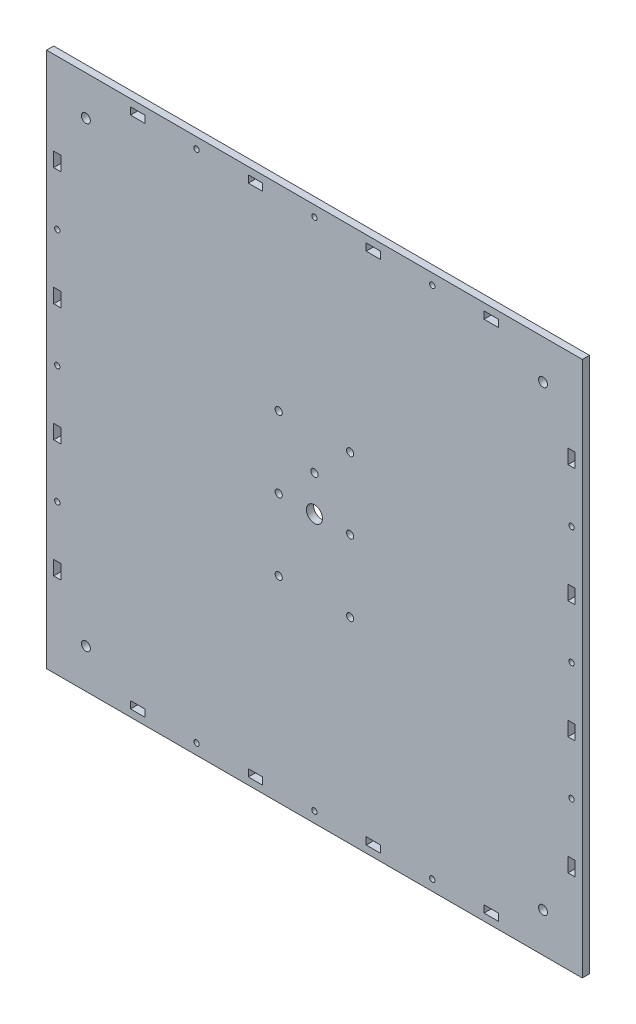
from build123d import *

# Parameters (mm, degrees)
SKETCH_1_R          = 4.5
SKETCH_1_R_2        = 2
EXTRUDE_1_DEPTH     = 4
SKETCH_2_R          = 2
CUT_EXTRUDE_1_DEPTH = 4
SKETCH_3_R          = 1.5
SKETCH_3_W          = 8.03
SKETCH_3_H          = 4.03
SKETCH_3_W_2        = 4.03
SKETCH_3_H_2        = 8.03
CUT_EXTRUDE_2_DEPTH = 4
SKETCH_5_R          = 2.5
CUT_EXTRUDE_4_DEPTH = 10


with BuildPart() as part:
    # 草图1 → 凸台-拉伸1 (new body)
    with BuildSketch(Plane.XY):
        Polygon((151.457142857, -41.187142857), (151.457142857, 108.812857143), (-148.542857143, 108.812857143), (-148.542857143, -191.187142857), (151.457142857, -191.187142857), align=None)
        with Locations((1.457142857, -41.187142857)):
            Circle(SKETCH_1_R, mode=Mode.SUBTRACT)
        with Locations((-18.542857143, -41.187142857)):
            Circle(SKETCH_1_R_2, mode=Mode.SUBTRACT)
        with Locations((-18.542857143, -1.187142857)):
            Circle(SKETCH_1_R_2, mode=Mode.SUBTRACT)
        with Locations((21.457142857, -1.187142857)):
            Circle(SKETCH_1_R_2, mode=Mode.SUBTRACT)
        with Locations((21.457142857, -41.187142857)):
            Circle(SKETCH_1_R_2, mode=Mode.SUBTRACT)
        with Locations(Location((21.457142857, -81.187142857, 0), (0, 0, 180))):
            Circle(SKETCH_1_R_2, mode=Mode.SUBTRACT)
        with Locations(Location((-18.542857143, -81.187142857, 0), (0, 0, 180))):
            Circle(SKETCH_1_R_2, mode=Mode.SUBTRACT)
    extrude(amount=EXTRUDE_1_DEPTH)

    # 草图2 → 切除-拉伸1 (cut)
    with BuildSketch(Plane.XY.offset(4)):
        with Locations((1.457142857, -21.187142857)):
            Circle(SKETCH_2_R)
    extrude(amount=-CUT_EXTRUDE_1_DEPTH, mode=Mode.SUBTRACT)

    # 草图3 → 切除-拉伸2 (cut)
    with BuildSketch(Plane.XY.offset(4)):
        with Locations((1.457142857, -185.187142857)):
            Circle(SKETCH_3_R)
        with Locations((67.457142857, -185.187142857)):
            Circle(SKETCH_3_R)
        with Locations(Location((-64.542857143, -185.187142857, 0), (0, 0, 180))):
            Circle(SKETCH_3_R)
        with Locations(Location((-142.542857143, 24.812857143, 0), (0, 0, 180))):
            Circle(SKETCH_3_R)
        with Locations((-142.542857143, -41.187142857)):
            Circle(SKETCH_3_R)
        with Locations((-142.542857143, -107.187142857)):
            Circle(SKETCH_3_R)
        with Locations(Location((67.457142857, 102.812857143, 0), (0, 0, 180))):
            Circle(SKETCH_3_R)
        with Locations((1.457142857, 102.812857143)):
            Circle(SKETCH_3_R)
        with Locations((-64.542857143, 102.812857143)):
            Circle(SKETCH_3_R)
        with Locations(Location((145.457142857, -107.187142857, 0), (0, 0, 180))):
            Circle(SKETCH_3_R)
        with Locations((145.457142857, -41.187142857)):
            Circle(SKETCH_3_R)
        with Locations((145.457142857, 24.812857143)):
            Circle(SKETCH_3_R)
        with Locations((100.457142857, -185.187142857)):
            Rectangle(SKETCH_3_W, SKETCH_3_H)
        with Locations((34.457142857, -185.187142857)):
            Rectangle(SKETCH_3_W, SKETCH_3_H)
        with Locations((-31.542857143, -185.187142857)):
            Rectangle(SKETCH_3_W, SKETCH_3_H)
        with Locations((-97.542857143, -185.187142857)):
            Rectangle(SKETCH_3_W, SKETCH_3_H)
        with Locations((-142.542857143, 57.812857143)):
            Rectangle(SKETCH_3_W_2, SKETCH_3_H_2)
        with Locations((-142.542857143, -8.187142857)):
            Rectangle(SKETCH_3_W_2, SKETCH_3_H_2)
        with Locations((-142.542857143, -74.187142857)):
            Rectangle(SKETCH_3_W_2, SKETCH_3_H_2)
        with Locations((-142.542857143, -140.187142857)):
            Rectangle(SKETCH_3_W_2, SKETCH_3_H_2)
        with Locations((100.457142857, 102.812857143)):
            Rectangle(SKETCH_3_W, SKETCH_3_H)
        with Locations((34.457142857, 102.812857143)):
            Rectangle(SKETCH_3_W, SKETCH_3_H)
        with Locations((-31.542857143, 102.812857143)):
            Rectangle(SKETCH_3_W, SKETCH_3_H)
        with Locations((-97.542857143, 102.812857143)):
            Rectangle(SKETCH_3_W, SKETCH_3_H)
        with Locations((145.457142857, -140.187142857)):
            Rectangle(SKETCH_3_W_2, SKETCH_3_H_2)
        with Locations((145.457142857, -74.187142857)):
            Rectangle(SKETCH_3_W_2, SKETCH_3_H_2)
        with Locations((145.457142857, -8.187142857)):
            Rectangle(SKETCH_3_W_2, SKETCH_3_H_2)
        with Locations((145.457142857, 57.812857143)):
            Rectangle(SKETCH_3_W_2, SKETCH_3_H_2)
    extrude(amount=-CUT_EXTRUDE_2_DEPTH, mode=Mode.SUBTRACT)

    # 草图5 → 切除-拉伸4 (cut)
    with BuildSketch(Plane.XY.offset(4)):
        with Locations((-126.542857143, 86.812857143)):
            Circle(SKETCH_5_R)
        with Locations((129.457142857, 86.812857143)):
            Circle(SKETCH_5_R)
        with Locations((129.457142857, -169.187142857)):
            Circle(SKETCH_5_R)
        with Locations((-126.542857143, -169.187142857)):
            Circle(SKETCH_5_R)
    extrude(amount=-CUT_EXTRUDE_4_DEPTH, mode=Mode.SUBTRACT)


solid = part.part
